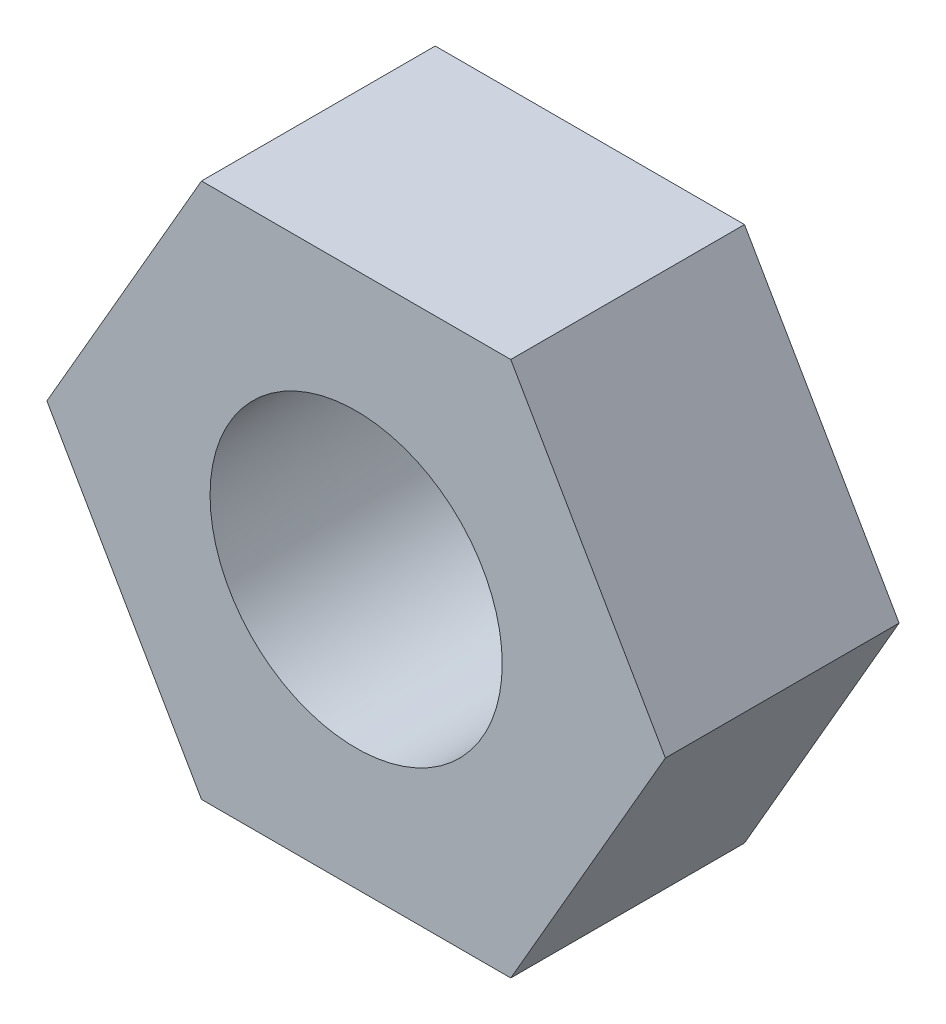
from build123d import *

# Parameters (mm, degrees)
SKETCH1_R = 1.5
NUT_DEPTH = 2.4


with BuildPart() as part:
    # Sketch1 → Nut (new body)
    with BuildSketch(Plane.XY):
        Polygon((3.175426481, 0), (1.58771324, 2.75), (-1.58771324, 2.75), (-3.175426481, 0), (-1.58771324, -2.75), (1.58771324, -2.75), align=None)
        Circle(SKETCH1_R, mode=Mode.SUBTRACT)
    extrude(amount=NUT_DEPTH)


solid = part.part
